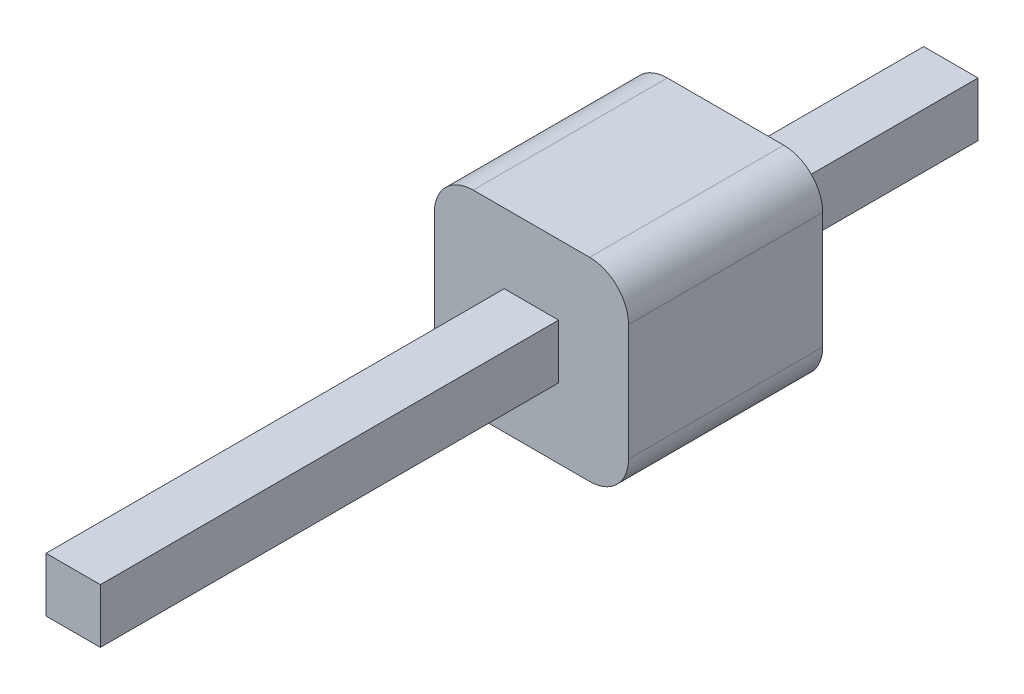
from build123d import *

# Parameters (mm, degrees)
CROQUIS1_W              = 0.7
CROQUIS1_H              = 0.7
SALIENTE_EXTRUIR1_DEPTH = 11.3
CROQUIS2_W              = 2.5
CROQUIS2_H              = 2.5
SALIENTE_EXTRUIR2_DEPTH = 2.5
REDONDEO1_R             = 0.5


with BuildPart() as part:
    # Croquis1 → Saliente-Extruir1 (new body)
    with BuildSketch(Plane.XY):
        Rectangle(CROQUIS1_W, CROQUIS1_H)
    extrude(amount=SALIENTE_EXTRUIR1_DEPTH)

    # Croquis2 → Saliente-Extruir2 (add)
    with BuildSketch(Plane(origin=(0, 0, 2.9), x_dir=(-1, 0, 0), z_dir=(0, 0, -1))):
        Rectangle(CROQUIS2_W, CROQUIS2_H)
    extrude(amount=-SALIENTE_EXTRUIR2_DEPTH)

    # Redondeo1
    redondeo1_edges = [part.edges().sort_by_distance(p)[0] for p in [
        (1.25, -1.25, 4.15),
        (1.25, 1.25, 4.15),
        (-1.25, 1.25, 4.15),
        (-1.25, -1.25, 4.15),
    ]]
    fillet(redondeo1_edges, radius=REDONDEO1_R)


solid = part.part
